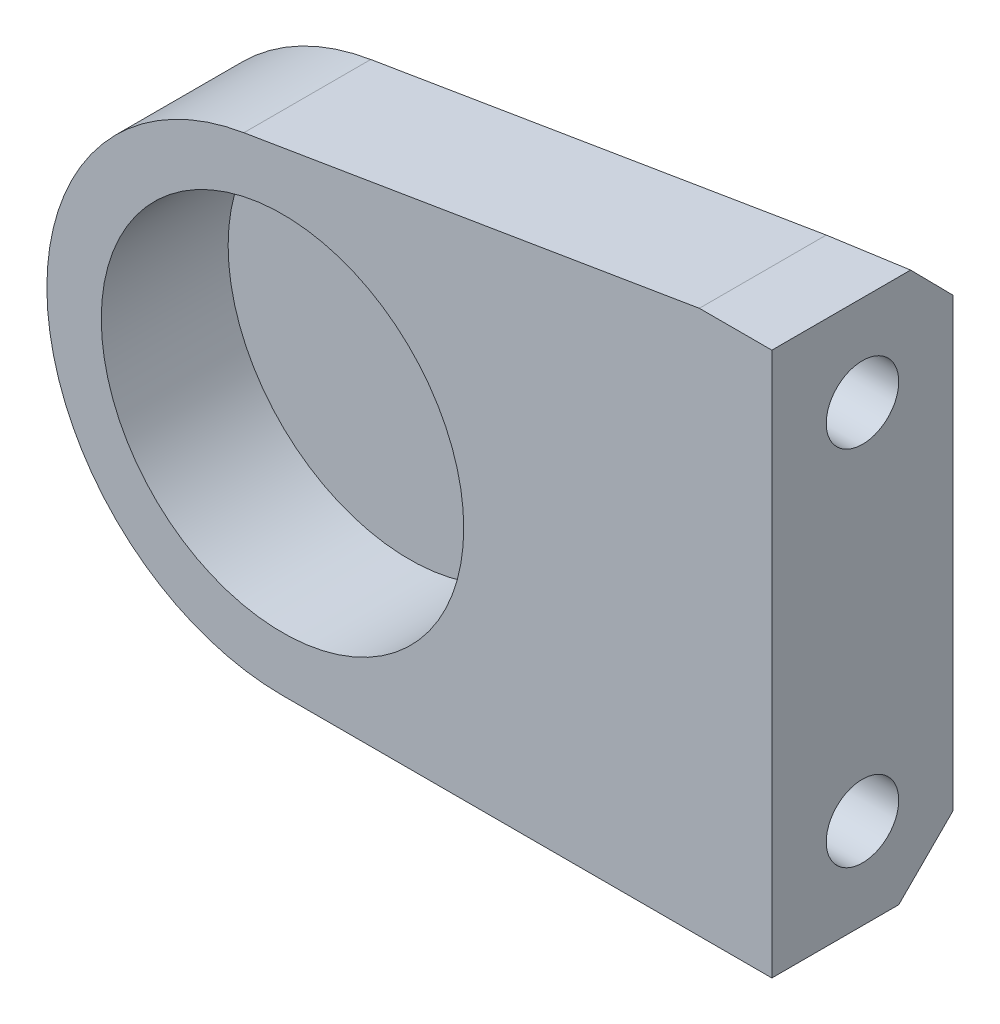
from build123d import *

# Parameters (mm, degrees)
BOSS_EXTRUDE1_DEPTH = 5
SKETCH2_R           = 5
CUT_EXTRUDE1_DEPTH  = 3.5
SKETCH3_R           = 1
CUT_EXTRUDE2_DEPTH  = 2
CHAMFER3_SIZE       = 1.5


with BuildPart() as part:
    # Sketch1 → Boss-Extrude1 (new body)
    with BuildSketch(Plane.XY):
        with BuildLine():
            Line((0, -6.5), (13.5, -6.5))
            Line((13.5, -6.5), (13.5, 8.5))
            Line((13.5, 8.5), (11.5, 8.5))
            Line((11.5, 8.5), (-1.065452768, 6.412083156))
            ThreePointArc((-1.065452768, 6.412083156), (-6.477983502, -0.534536942), (0, -6.5))
        make_face()
    extrude(amount=BOSS_EXTRUDE1_DEPTH)

    # Sketch2 → Cut-Extrude1 (cut)
    with BuildSketch(Plane.XY.offset(5)):
        Circle(SKETCH2_R)
    extrude(amount=-CUT_EXTRUDE1_DEPTH, mode=Mode.SUBTRACT)

    # Sketch3 → Cut-Extrude2 (cut)
    with BuildSketch(Plane(origin=(13.5, 0, 0), x_dir=(0, 0, -1), z_dir=(1, 0, 0))):
        with Locations((-2.5, 6)):
            Circle(SKETCH3_R)
        with Locations(Location((-2.5, -4, 0), (0, 0, 180))):
            Circle(SKETCH3_R)
    extrude(amount=-CUT_EXTRUDE2_DEPTH, mode=Mode.SUBTRACT)

    # Chamfer3
    chamfer3_edges = [part.edges().sort_by_distance(p)[0] for p in [
        (5.217273616, 7.456041578, 0),
        (-6.477983502, -0.534536942, 0),
        (6.75, -6.5, 0),
    ]]
    chamfer(chamfer3_edges, length=CHAMFER3_SIZE)


solid = part.part
